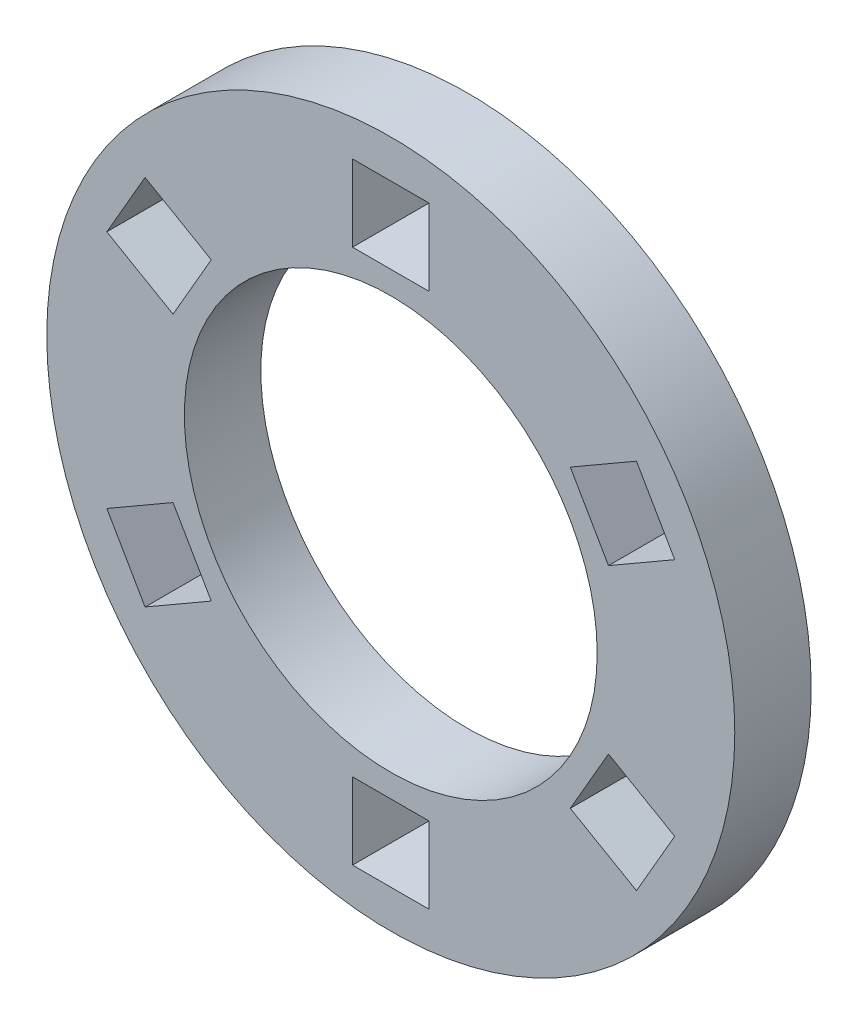
from build123d import *

# Parameters (mm, degrees)
SKETCH1_R           = 22.5
SKETCH1_R_2         = 13.5
SKETCH1_W           = 5
SKETCH1_H           = 5
BOSS_EXTRUDE1_DEPTH = 5


with BuildPart() as part:
    # Sketch1 → Boss-Extrude1 (new body)
    with BuildSketch(Plane.XY):
        Circle(SKETCH1_R)
        Circle(SKETCH1_R_2, mode=Mode.SUBTRACT)
        with Locations((0, 17.5)):
            Rectangle(SKETCH1_W, SKETCH1_H, mode=Mode.SUBTRACT)
        Polygon((18.570508076, 7.834936491), (14.240381057, 5.334936491), (11.740381057, 9.665063509), (16.070508076, 12.165063509), align=None, mode=Mode.SUBTRACT)
        Polygon((16.070508076, -12.165063509), (11.740381057, -9.665063509), (14.240381057, -5.334936491), (18.570508076, -7.834936491), align=None, mode=Mode.SUBTRACT)
        with Locations((0, -17.5)):
            Rectangle(SKETCH1_W, SKETCH1_H, mode=Mode.SUBTRACT)
        Polygon((-18.570508076, -7.834936491), (-14.240381057, -5.334936491), (-11.740381057, -9.665063509), (-16.070508076, -12.165063509), align=None, mode=Mode.SUBTRACT)
        Polygon((-16.070508076, 12.165063509), (-11.740381057, 9.665063509), (-14.240381057, 5.334936491), (-18.570508076, 7.834936491), align=None, mode=Mode.SUBTRACT)
    extrude(amount=BOSS_EXTRUDE1_DEPTH)


solid = part.part
